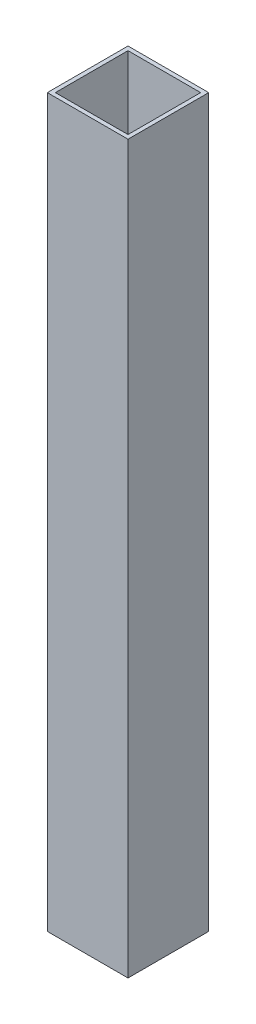
from build123d import *

# Parameters (mm, degrees)
SKETCH1_W           = 50.8
SKETCH1_H           = 457.2
BOSS_EXTRUDE1_DEPTH = 50.8
SHELL1_T            = -2.54
SKETCH2_W           = 45.72
SKETCH2_H           = 45.72
CUT_EXTRUDE1_DEPTH  = 50.8


with BuildPart() as part:
    # Sketch1 → Boss-Extrude1 (new body)
    with BuildSketch(Plane.XY):
        with Locations((25.4, -228.6)):
            Rectangle(SKETCH1_W, SKETCH1_H)
    extrude(amount=BOSS_EXTRUDE1_DEPTH)

    # Shell1
    shell1_openings = [part.faces().sort_by_distance(p)[0] for p in [
        (25.4, 0, 25.4),
    ]]
    offset(amount=SHELL1_T, openings=shell1_openings, kind=Kind.INTERSECTION)

    # Sketch2 → Cut-Extrude1 (cut)
    with BuildSketch(Plane.XZ.offset(457.2)):
        with Locations((25.4, 25.4)):
            Rectangle(SKETCH2_W, SKETCH2_H)
    extrude(amount=-CUT_EXTRUDE1_DEPTH, mode=Mode.SUBTRACT)


solid = part.part
